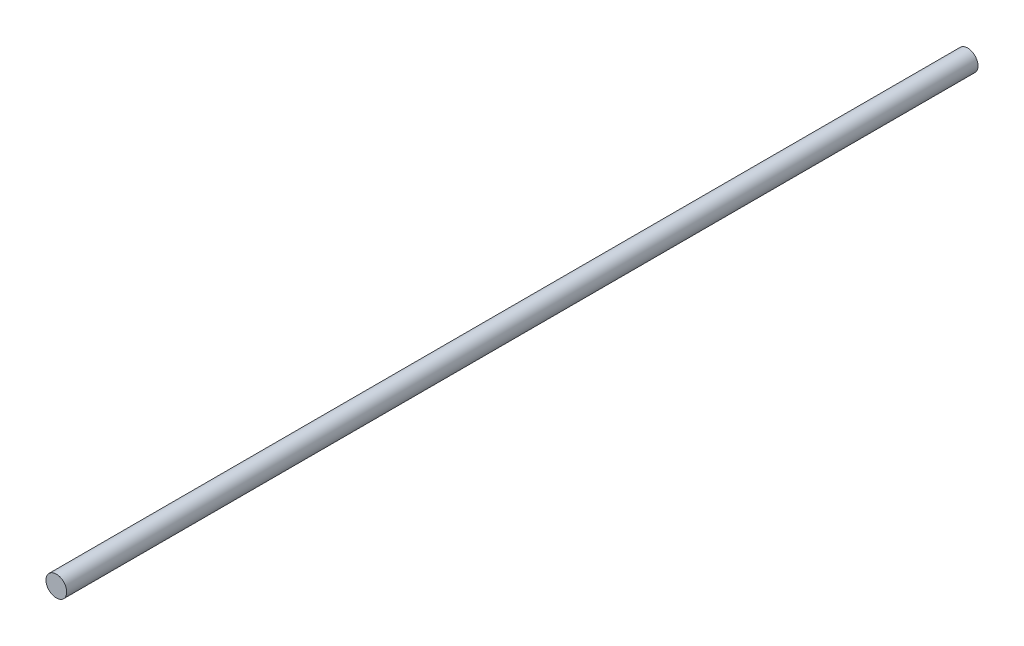
from build123d import *

# Parameters (mm, degrees)
ESQUISSE1_R      = 3
EXTRUSION1_DEPTH = 264


with BuildPart() as part:
    # Esquisse1 → Extrusion1 (new body)
    with BuildSketch(Plane.XY):
        Circle(ESQUISSE1_R)
    extrude(amount=EXTRUSION1_DEPTH)


solid = part.part
